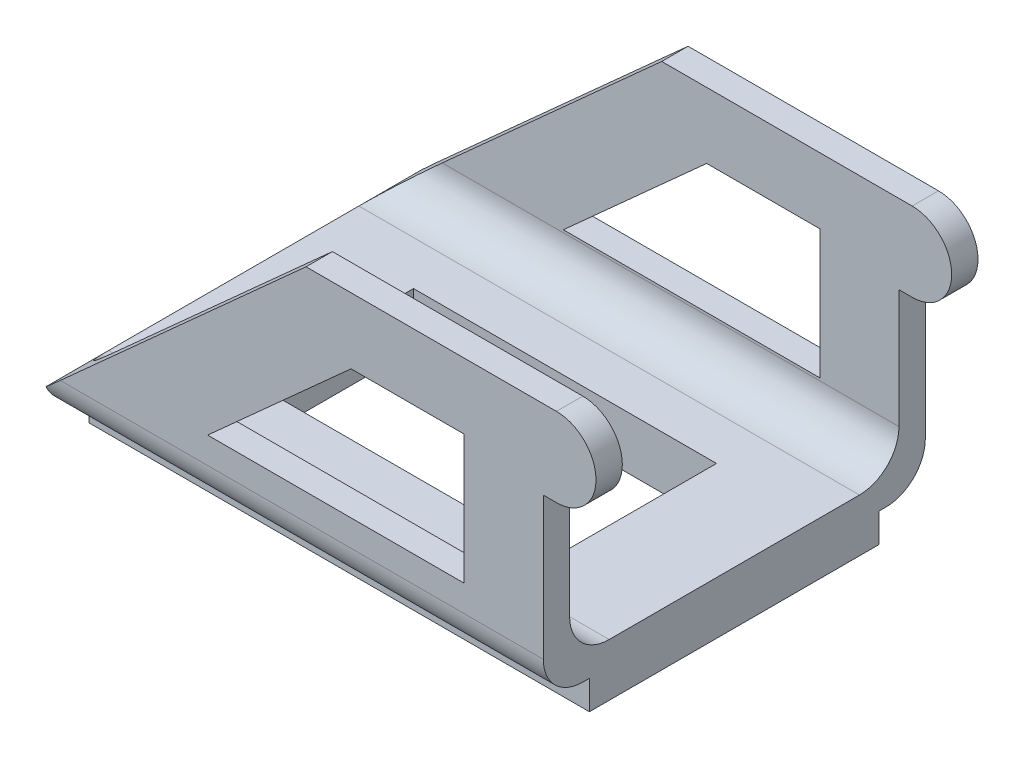
from build123d import *

# Parameters (mm, degrees)
SKETCH1_W           = 38
SKETCH1_H           = 22
SKETCH1_W_2         = 23
SKETCH1_H_2         = 12.3
BOSS_EXTRUDE1_DEPTH = 4
BOSS_EXTRUDE2_DEPTH = 42
FILLET1_R           = 3
SKETCH4_W           = 4
SKETCH4_H           = 4.046186486
CUT_EXTRUDE1_DEPTH  = 44.058100283
CUT_EXTRUDE2_DEPTH  = 44.058100283
SKETCH7_R           = 1
BOSS_EXTRUDE3_DEPTH = 1.2
FILLET2_R           = 0.5


with BuildPart() as part:
    # Sketch1 → Boss-Extrude1 (new body)
    with BuildSketch(Plane(origin=(0, 0, 0), x_dir=(1, 0, 0), z_dir=(0, 1, 0))):
        Rectangle(SKETCH1_W, SKETCH1_H)
        Rectangle(SKETCH1_W_2, SKETCH1_H_2, mode=Mode.SUBTRACT)
    extrude(amount=BOSS_EXTRUDE1_DEPTH)

    # Sketch2 → Boss-Extrude2 (add)
    with BuildSketch(Plane.ZY.offset(19)):
        Polygon((-11, 2.2), (-14.5, 2.2), (-14.5, 22), (-12.5, 22), (-12.5, 4), (-11, 4), align=None)
        Polygon((12.5, 4), (11, 4), (11, 2.2), (14.5, 2.2), (14.5, 22), (12.5, 22), align=None)
    extrude(amount=-BOSS_EXTRUDE2_DEPTH)

    # Fillet1
    fillet1_edges = [part.edges().sort_by_distance(p)[0] for p in [
        (2, 2.2, 14.5),
        (2, 2.2, -14.5),
        (2, 4, 12.5),
        (2, 4, -12.5),
    ]]
    fillet(fillet1_edges, radius=FILLET1_R)

    # Sketch4 → Cut-Extrude1 (cut, through all)
    with BuildSketch(Plane(origin=(0, 0, -14.5), x_dir=(-1, 0, 0), z_dir=(0, 0, -1))):
        with Locations((-21, 3.176906757)):
            Rectangle(SKETCH4_W, SKETCH4_H)
        with BuildLine():
            Line((-23, 5.2), (-19, 5.2))
            Line((-19, 5.2), (-19, 16))
            Line((-19, 16), (-20, 16))
            ThreePointArc((-20, 16), (-22.121320344, 16.878679656), (-23, 19))
            Line((-23, 19), (-23, 5.2))
        make_face()
        with BuildLine():
            ThreePointArc((-23, 19), (-22.121320344, 21.121320344), (-20, 22))
            Line((-20, 22), (-23, 22))
            Line((-23, 22), (-23, 19))
        make_face()
        Polygon((-0.991025267, 22), (17.667264982, 5.2), (19, 5.2), (19, 22), align=None)
        Polygon((17.667264982, 5.2), (19, 4), (19, 5.2), align=None)
    extrude(amount=-CUT_EXTRUDE1_DEPTH, mode=Mode.SUBTRACT)

    # Sketch6 → Cut-Extrude2 (cut, through all)
    with BuildSketch(Plane(origin=(0, 0, -14.5), x_dir=(-1, 0, 0), z_dir=(0, 0, -1))):
        Polygon((6.479180653, 7.2), (-13, 7.2), (-13, 17), (-4.404821992, 17), align=None)
    extrude(amount=-CUT_EXTRUDE2_DEPTH, mode=Mode.SUBTRACT)

    # Sketch7 → Boss-Extrude3 (add)
    with BuildSketch(Plane(origin=(0, 0, -14.5), x_dir=(-1, 0, 0), z_dir=(0, 0, -1))):
        with Locations((-20, 19)):
            Circle(SKETCH7_R)
    extrude(amount=BOSS_EXTRUDE3_DEPTH)

    # Fillet2
    fillet2_edges = [part.edges().sort_by_distance(p)[0] for p in [
        (21, 19, -15.7),
    ]]
    fillet(fillet2_edges, radius=FILLET2_R)


solid = part.part
